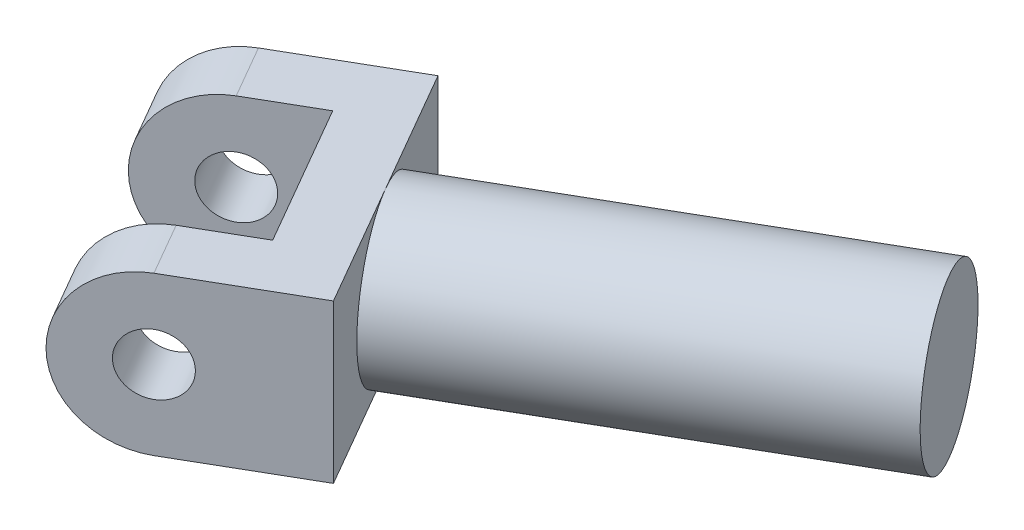
from build123d import *
from build123d.topology import SkipClean

# Parameters (mm, degrees)
BOSS_EXTRUDE1_DEPTH = 25
SKETCH2_R           = 8
CUT_EXTRUDE1_DEPTH  = 110
CUT_EXTRUDE2_DEPTH  = 150
BOSS_EXTRUDE2_START = 21.60254038
BOSS_EXTRUDE2_DEPTH = 21.60254038
SKETCH5_R           = 13
CUT_EXTRUDE3_DEPTH  = 50
SKETCH6_R           = 13
BOSS_EXTRUDE3_DEPTH = 100
SKETCH7_R           = 5
CUT_EXTRUDE4_DEPTH  = 50
SKETCH8_R           = 13
SKETCH8_R_2         = 5
BOSS_EXTRUDE4_DEPTH = 13
CUT_EXTRUDE5_DEPTH  = 28
SKETCH10_R          = 5
BOSS_EXTRUDE5_DEPTH = 10
CIRPATTERN2_COUNT   = 2
SKETCH11_W          = 47
SKETCH11_H          = 26
BOSS_EXTRUDE6_DEPTH = 10
SKETCH12_R          = 13
BOSS_EXTRUDE7_DEPTH = 67.86279097
SCALE1_SCALE        = 3.5


with BuildPart() as part:
    # Sketch1 → Boss-Extrude1 (new, symmetric)
    with BuildSketch(Plane(origin=(0, 0, 0), x_dir=(1, 0, 0), z_dir=(0, 1, 0))):
        Polygon((86.602540378, 150), (103.923048454, 160), (114.724318643, 141.291651246), (93.073683549, 128.791651246), (158.073683549, 16.208348754), (179.724318643, 28.708348754), (190.525588833, 10), (173.205080757, 0), (45.59802172, 0), (22.79901086, 39.489045172), align=None)
    extrude(amount=BOSS_EXTRUDE1_DEPTH, both=True)

    # Sketch2 → Cut-Extrude1 (cut, symmetric)
    with BuildSketch(Plane(origin=(140.729128115, 0, -81.25), x_dir=(0.8660254037844386, 0, -0.5000000000000003), z_dir=(0.5000000000000003, 0, 0.8660254037844386))):
        Circle(SKETCH2_R)
    extrude(amount=CUT_EXTRUDE1_DEPTH, both=True, mode=Mode.SUBTRACT)

    # Sketch3 → Cut-Extrude2 (cut, symmetric)
    with BuildSketch(Plane(origin=(140.729128115, 0, -81.25), x_dir=(0.8660254037844386, 0, -0.5000000000000003), z_dir=(0.5000000000000003, 0, 0.8660254037844386))):
        with BuildLine():
            Line((0, 18), (-12.5, 18))
            Line((-12.5, 18), (-12.5, 31.312178452))
            Line((-12.5, 31.312178452), (23.905899442, 31.312178452))
            Line((23.905899442, 31.312178452), (23.905899442, -29.505210198))
            Line((23.905899442, -29.505210198), (-12.5, -29.505210198))
            Line((-12.5, -29.505210198), (-12.5, -18))
            Line((-12.5, -18), (0, -18))
            ThreePointArc((0, -18), (18, 0), (0, 18))
        make_face()
    extrude(amount=CUT_EXTRUDE2_DEPTH, both=True, mode=Mode.SUBTRACT)

    # Sketch4 → Boss-Extrude2 (add)
    with SkipClean():  # the faces are left unmerged after this step: merging them gives an invalid solid
        with BuildSketch(Plane(origin=(173.229128115, 0, -24.958348754), x_dir=(0.8660254037844386, 0, -0.5000000000000003), z_dir=(0.5000000000000003, 0, 0.8660254037844386)).offset(BOSS_EXTRUDE2_START)):
            with BuildLine():
                Line((7.5, 16.363068172), (7.5, 2.783882181))
                ThreePointArc((7.5, 2.783882181), (8, 0), (7.5, -2.783882181))
                Line((7.5, -2.783882181), (7.5, -16.363068172))
                ThreePointArc((7.5, -16.363068172), (18, 0), (7.5, 16.363068172))
            make_face()
        boss_extrude2 = extrude(amount=-BOSS_EXTRUDE2_DEPTH)

    # Mirror2: Boss-Extrude2 across plane
    with SkipClean():  # the faces are left unmerged after this step: merging them gives an invalid solid
        add(boss_extrude2.mirror(Plane(origin=(140.729128115, 0, -81.25), x_dir=(-0.8660254037844388, 0, 0.5), z_dir=(0.5000000000000003, 0, 0.8660254037844386))))

    # Sketch5 → Cut-Extrude3 (cut)
    with SkipClean():  # the faces are left unmerged after this step: merging them gives an invalid solid
        with BuildSketch(Plane(origin=(34.19851629, 0, -19.744522586), x_dir=(0.5000000000000001, 0, 0.8660254037844386), z_dir=(-0.8660254037844386, 0, 0.5000000000000001))):
            Circle(SKETCH5_R)
        extrude(amount=-CUT_EXTRUDE3_DEPTH, mode=Mode.SUBTRACT)


with BuildPart() as body_2:
    # Sketch6 → Boss-Extrude3 (new body)
    with BuildSketch(Plane(origin=(77.499786479, 0, -44.744522586), x_dir=(0.5000000000000001, 0, 0.8660254037844386), z_dir=(-0.8660254037844386, 0, 0.5000000000000001))):
        Circle(SKETCH6_R)
    extrude(amount=BOSS_EXTRUDE3_DEPTH)

    # Sketch7 → Cut-Extrude4 (cut, symmetric)
    with BuildSketch(Plane(origin=(140.729128115, 0, -81.25), x_dir=(0.8660254037844386, 0, -0.5000000000000003), z_dir=(0.5000000000000003, 0, 0.8660254037844386))):
        with Locations((-162.5, 0)):
            Circle(SKETCH7_R)
    extrude(amount=CUT_EXTRUDE4_DEPTH, both=True, mode=Mode.SUBTRACT)

    # Sketch8 → Boss-Extrude4 (add, symmetric)
    with BuildSketch(Plane(origin=(140.729128115, 0, -81.25), x_dir=(0.8660254037844386, 0, -0.5000000000000003), z_dir=(0.5000000000000003, 0, 0.8660254037844386))):
        with Locations((-162.5, 0)):
            Circle(SKETCH8_R)
        with Locations((-162.5, 0)):
            Circle(SKETCH8_R_2, mode=Mode.SUBTRACT)
    extrude(amount=BOSS_EXTRUDE4_DEPTH, both=True)

    # Sketch9 → Cut-Extrude5 (cut, symmetric)
    with BuildSketch(Plane(origin=(140.729128115, 0, -81.25), x_dir=(0.8660254037844386, 0, -0.5000000000000003), z_dir=(0.5000000000000003, 0, 0.8660254037844386))):
        with BuildLine():
            Line((-162.5, 13), (-162.5, 18.834095503))
            ThreePointArc((-162.5, 18.834095503), (-181.334095503, 0), (-162.5, -18.834095503))
            Line((-162.5, -18.834095503), (-162.5, -13))
            ThreePointArc((-162.5, -13), (-175.5, 0), (-162.5, 13))
        make_face()
    extrude(amount=CUT_EXTRUDE5_DEPTH, both=True, mode=Mode.SUBTRACT)


with BuildPart() as body_2_2:
    # Sketch10 → Boss-Extrude5 (new body)
    with BuildSketch(Plane(origin=(6.75, 0, 11.691342951), x_dir=(0.8660254037844385, 0, -0.5000000000000004), z_dir=(0.5000000000000003, 0, 0.8660254037844384))):
        with BuildLine():
            Line((0, 13), (21.626254201, 13))
            Line((21.626254201, 13), (21.626254201, -13))
            Line((21.626254201, -13), (0, -13))
            ThreePointArc((0, -13), (-13, 0), (0, 13))
        make_face()
        Circle(SKETCH10_R, mode=Mode.SUBTRACT)
    extrude(amount=BOSS_EXTRUDE5_DEPTH)


with BuildPart() as cirpattern2_1:
    # CirPattern2: pattern copy
    add(body_2_2.part.rotate(Axis((24.24994662, 0, -14.000713209), (0.8660254037844386, 0, -0.5000000000000003)), 1 * 360 / CIRPATTERN2_COUNT))


with BuildPart() as body_4:
    # Sketch11 → Boss-Extrude6 (new body)
    with BuildSketch(Plane(origin=(18.728885527, 0, -10.8131271), x_dir=(-0.5000000000000004, 0, -0.8660254037844385), z_dir=(0.8660254037844384, 0, -0.5000000000000003))):
        Rectangle(SKETCH11_W, SKETCH11_H)
    extrude(amount=-BOSS_EXTRUDE6_DEPTH)


with BuildPart() as body_5:
    # Sketch12 → Boss-Extrude7 (new body)
    with BuildSketch(Plane(origin=(18.728885527, 0, -10.8131271), x_dir=(-0.5000000000000004, 0, -0.8660254037844385), z_dir=(0.8660254037844384, 0, -0.5000000000000003))):
        Circle(SKETCH12_R)
    extrude(amount=BOSS_EXTRUDE7_DEPTH)


with BuildPart() as cirpattern2_1_1:
    add(cirpattern2_1.part)

    # Combine2: union body 4, body 5, body 2 2
    add(body_4.part)
    add(body_5.part)
    add(body_2_2.part)


with BuildPart() as cirpattern2_1_2:
    # Scale1: scaled about (0, 0, 0)
    add(cirpattern2_1_1.part.scale(SCALE1_SCALE))


solid = cirpattern2_1_2.part
